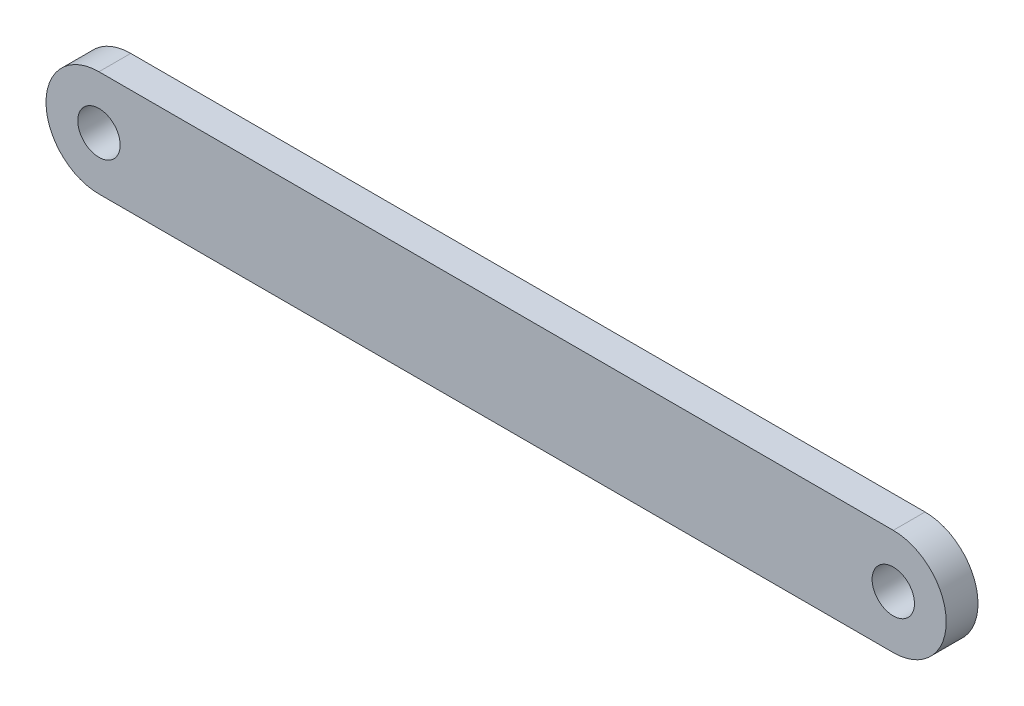
from build123d import *

# Parameters (mm, degrees)
SKETCH1_R           = 2
BOSS_EXTRUDE1_DEPTH = 3


with BuildPart() as part:
    # Sketch1 → Boss-Extrude1 (new body)
    with BuildSketch(Plane.XY):
        with BuildLine():
            Line((120.078651701, 190.032322866), (195.078651701, 190.032322866))
            ThreePointArc((195.078651701, 190.032322866), (200.078651701, 195.032322866), (195.078651701, 200.032322866))
            Line((195.078651701, 200.032322866), (120.078651701, 200.032322866))
            ThreePointArc((120.078651701, 200.032322866), (115.078651701, 195.032322866), (120.078651701, 190.032322866))
        make_face()
        with Locations((120.078651701, 195.032322866)):
            Circle(SKETCH1_R, mode=Mode.SUBTRACT)
        with Locations((195.078651701, 195.032322866)):
            Circle(SKETCH1_R, mode=Mode.SUBTRACT)
    extrude(amount=BOSS_EXTRUDE1_DEPTH)


solid = part.part
